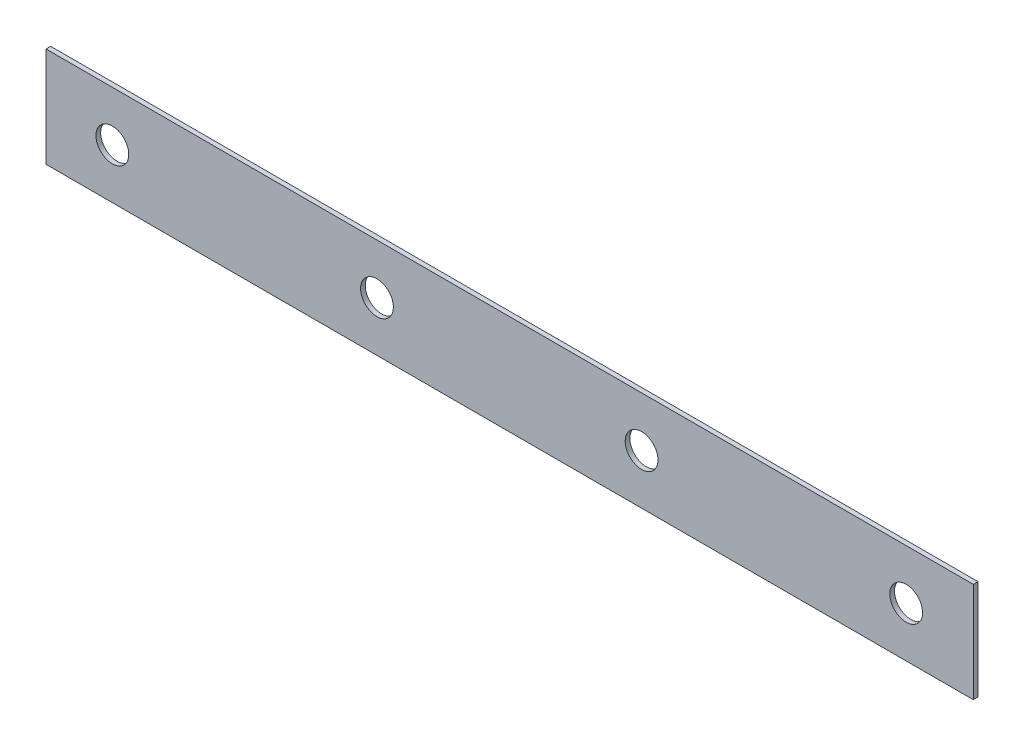
from build123d import *

# Parameters (mm, degrees)
ESQUISSE1_W        = 594
ESQUISSE1_H        = 64
ESQUISSE1_R        = 10.5
BOSS_EXTRU_1_DEPTH = 3


with BuildPart() as part:
    # Esquisse1 → Boss.-Extru.1 (new body)
    with BuildSketch(Plane.XY):
        with Locations((297, 32)):
            Rectangle(ESQUISSE1_W, ESQUISSE1_H)
        with Locations((42.5, 32)):
            Circle(ESQUISSE1_R, mode=Mode.SUBTRACT)
        with Locations(Location((381.5, 32, 0), (0, 0, 180))):
            Circle(ESQUISSE1_R, mode=Mode.SUBTRACT)
        with Locations(Location((551, 32, 0), (0, 0, 180))):
            Circle(ESQUISSE1_R, mode=Mode.SUBTRACT)
        with Locations((212, 32)):
            Circle(ESQUISSE1_R, mode=Mode.SUBTRACT)
    extrude(amount=BOSS_EXTRU_1_DEPTH)


solid = part.part
